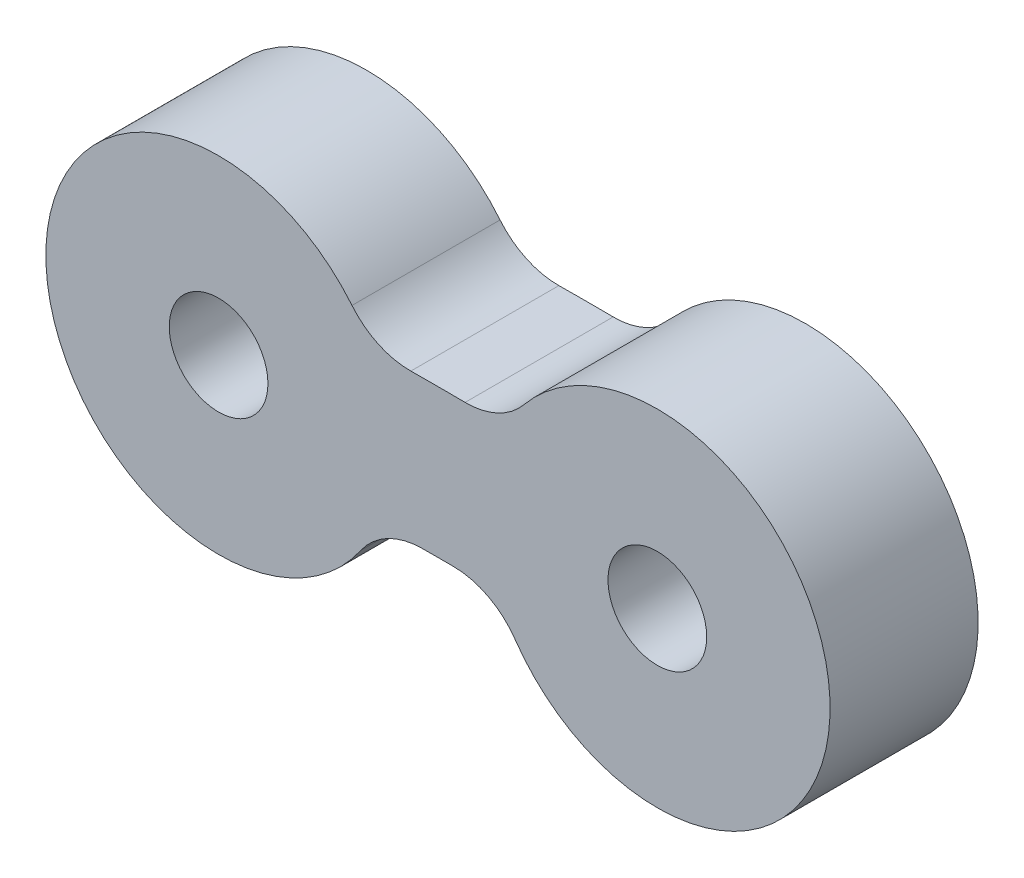
from build123d import *

# Parameters (mm, degrees)
SKETCH_1_R      = 1
EXTRUDE_1_DEPTH = 3
FILLET_1_R      = 1.524


with BuildPart() as part:
    # 스케치1 → 보스-돌출1 (new body)
    with BuildSketch(Plane.XY):
        with BuildLine():
            ThreePointArc((1.360201973, -0.016393318), (7.940776925, -1.84176367), (1.212873871, -3.012773539))
            ThreePointArc((1.212873871, -3.012773539), (0, -2.999007865), (-1.212873871, -3.012773539))
            ThreePointArc((-1.212873871, -3.012773539), (-7.940776925, -1.84176367), (-1.360201973, -0.016393318))
            ThreePointArc((-1.360201973, -0.016393318), (0, 0), (1.360201973, -0.016393318))
        make_face()
        with Locations((-4.445, -1.669880884)):
            Circle(SKETCH_1_R, mode=Mode.SUBTRACT)
        with Locations((4.445, -1.669880884)):
            Circle(SKETCH_1_R, mode=Mode.SUBTRACT)
    extrude(amount=EXTRUDE_1_DEPTH)

    # 필렛1
    fillet_1_edges = [part.edges().sort_by_distance(p)[0] for p in [
        (-1.360201973, -0.016393318, 1.5),
        (1.360201973, -0.016393318, 1.5),
        (1.212873871, -3.012773539, 1.5),
        (-1.212873871, -3.012773539, 1.5),
    ]]
    fillet(fillet_1_edges, radius=FILLET_1_R)


solid = part.part
